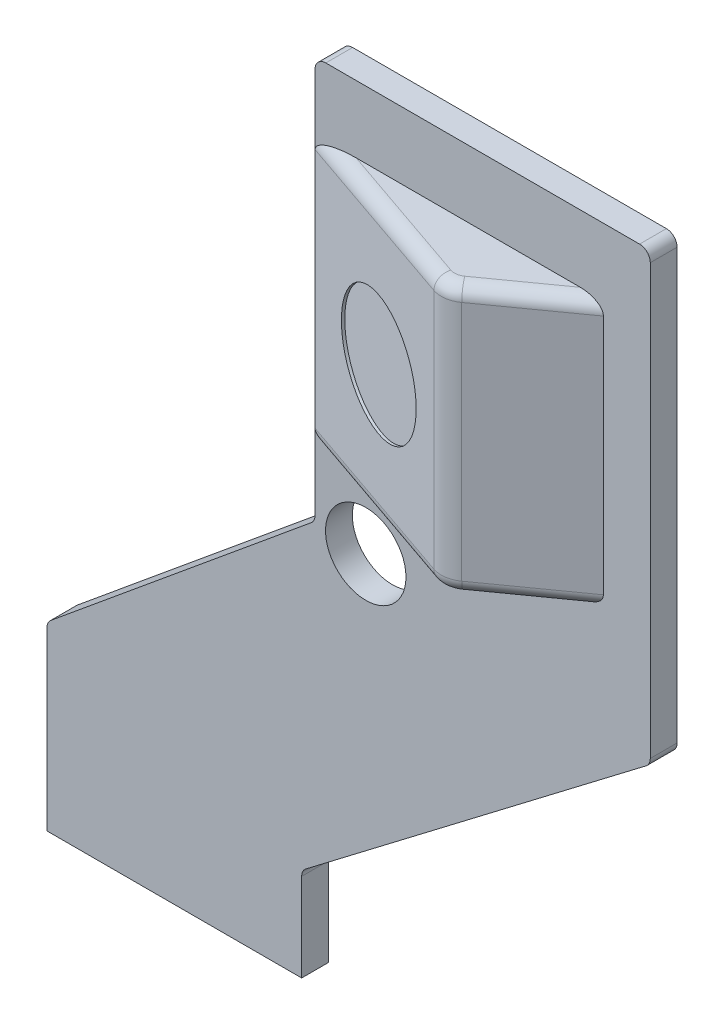
from build123d import *

# Parameters (mm, degrees)
BOSS_EXTRUDE1_DEPTH = 2
BOSS_EXTRUDE3_DEPTH = 20
SKETCH7_R           = 4.5
CUT_EXTRUDE1_DEPTH  = 0.2
SKETCH8_R           = 3
CUT_EXTRUDE2_DEPTH  = 38.831864876
FILLET3_R           = 2
FILLET4_R           = 1
FILLET5_R           = 0.8


with BuildPart() as part:
    # Sketch1 → Boss-Extrude1 (new body)
    with BuildSketch(Plane.XY):
        Polygon((-2.5, 30), (22.5, 30), (22.5, -3.215927905), (-3.5, -23.03885463), (-3.5, -30), (-22.5, -30), (-22.5, -16.5), (-2.5, 0), align=None)
    extrude(amount=-BOSS_EXTRUDE1_DEPTH)

    # Sketch6 → Boss-Extrude3 (add)
    with BuildSketch(Plane(origin=(0, 25, 0), x_dir=(-1, 0, 0), z_dir=(0, 1, 0))):
        Polygon((2.5, 0), (-12, 5), (-19, 0), align=None)
    extrude(amount=-BOSS_EXTRUDE3_DEPTH)

    # Sketch7 → Cut-Extrude1 (cut)
    with BuildSketch(Plane(origin=(-0.265674814, 0, 0.770456961), x_dir=(0.9453729816262723, 0, 0.3259906833194039), z_dir=(-0.3259906833194039, 0, 0.9453729816262723))):
        with Locations((5.305498371, 15)):
            Circle(SKETCH7_R)
    extrude(amount=-CUT_EXTRUDE1_DEPTH, mode=Mode.SUBTRACT)

    # Sketch8 → Cut-Extrude2 (cut, through all)
    with BuildSketch(Plane.XY):
        with Locations((1.279211248, -0.215927905)):
            Circle(SKETCH8_R)
    extrude(amount=-CUT_EXTRUDE2_DEPTH, mode=Mode.SUBTRACT)

    # Fillet3
    fillet3_edges = [part.edges().sort_by_distance(p)[0] for p in [
        (12, 15, 5),
    ]]
    fillet(fillet3_edges, radius=FILLET3_R)

    # Fillet4
    fillet4_edges = [part.edges().sort_by_distance(p)[0] for p in [
        (11.964055432, 5, 4.752278398),
        (15.919669033, 5, 2.200236405),
        (4.262440156, 5, 2.331875916),
        (4.262440156, 25, 2.331875916),
        (11.964055432, 25, 4.752278398),
        (15.919669033, 25, 2.200236405),
    ]]
    fillet(fillet4_edges, radius=FILLET4_R)

    # Fillet5
    fillet5_edges = [part.edges().sort_by_distance(p)[0] for p in [
        (-2.5, 0, -1),
        (-22.5, -16.5, -1),
        (-3.5, -23.03885463, -1),
        (22.5, -3.215927905, -1),
        (-2.5, 30, -1),
        (22.5, 30, -1),
    ]]
    fillet(fillet5_edges, radius=FILLET5_R)


solid = part.part
